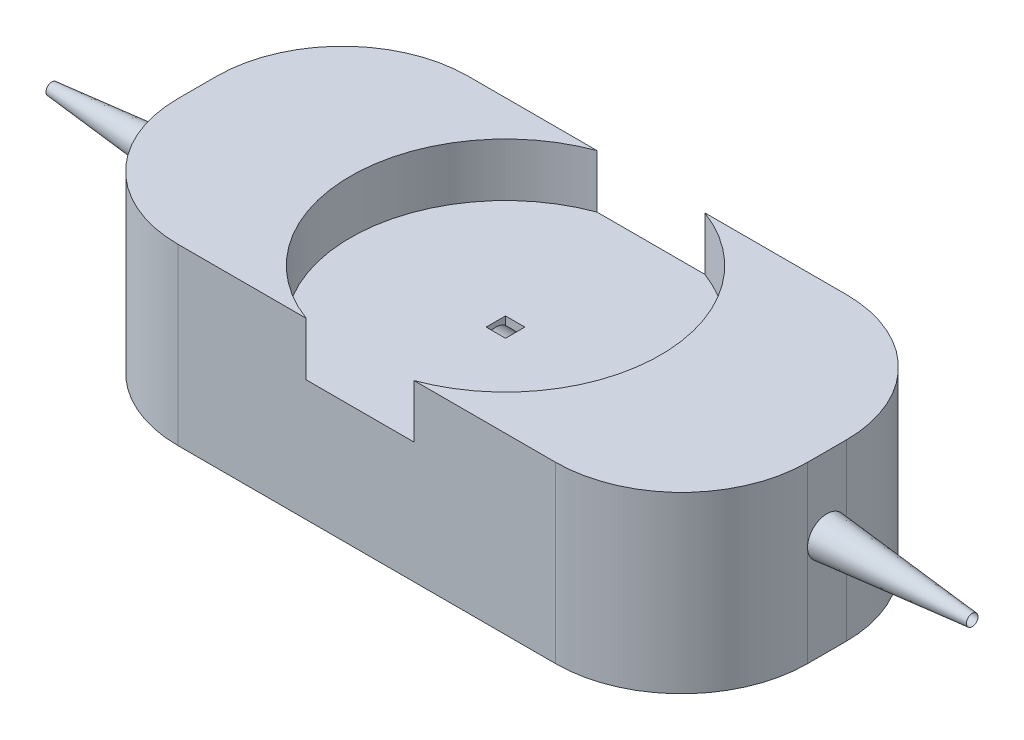
from build123d import *

# Parameters (mm, degrees)
SKETCH1_W           = 65
SKETCH1_H           = 30
BOSS_EXTRUDE1_DEPTH = 58
FILLET1_R           = 13
SKETCH15_W          = 83.696095513
SKETCH15_H          = 31.69844841
CUT_EXTRUDE7_DEPTH  = 50
SKETCH18_R          = 16
CUT_EXTRUDE10_DEPTH = 5.5
CUT_EXTRUDE12_REACH = 90.397
SKETCH3_R           = 1.6
SKETCH21_W          = 2
SKETCH21_H          = 2
CUT_EXTRUDE13_DEPTH = 8


with BuildPart() as part:
    # Sketch1 → Boss-Extrude1 (new body)
    with BuildSketch(Plane(origin=(0, 0, 0), x_dir=(1, 0, 0), z_dir=(0, 1, 0))):
        with Locations((7.5, 0)):
            Rectangle(SKETCH1_W, SKETCH1_H)
    extrude(amount=BOSS_EXTRUDE1_DEPTH)

    # Fillet1
    fillet1_edges = [part.edges().sort_by_distance(p)[0] for p in [
        (40, 29, 15),
        (-25, 29, 15),
        (-25, 29, -15),
        (40, 29, -15),
    ]]
    fillet(fillet1_edges, radius=FILLET1_R)

    # Sketch15 → Cut-Extrude7 (cut)
    with BuildSketch(Plane(origin=(0, -10, 0), x_dir=(-1, 0, 0), z_dir=(0, -1, 0))):
        with Locations((-0.057440767, 0.030479277)):
            Rectangle(SKETCH15_W, SKETCH15_H)
    extrude(amount=-CUT_EXTRUDE7_DEPTH, mode=Mode.SUBTRACT)

    # Sketch18 → Cut-Extrude10 (cut)
    with BuildSketch(Plane(origin=(0, 58, 0), x_dir=(1, 0, 0), z_dir=(0, 1, 0))):
        with Locations((6.828508286, 0)):
            Circle(SKETCH18_R)
    extrude(amount=-CUT_EXTRUDE10_DEPTH, mode=Mode.SUBTRACT)

    # Sketch3 → Cut-Extrude12 (cut, up to next)
    with BuildSketch(Plane.ZY.offset(25), mode=Mode.PRIVATE) as cut_extrude12_sk1:
        with Locations((0, 50.4)):
            Circle(SKETCH3_R)
    cut_extrude12_tool1 = extrude(cut_extrude12_sk1.sketch, amount=-CUT_EXTRUDE12_REACH, mode=Mode.PRIVATE) & part.part
    add(cut_extrude12_tool1.solids().sort_by_distance((-25, 50.4, 0))[0], mode=Mode.SUBTRACT)

    # Sketch21 → Cut-Extrude13 (cut)
    with BuildSketch(Plane(origin=(0, 52.5, 0), x_dir=(1, 0, 0), z_dir=(0, 1, 0))):
        with Locations((6.828508286, 0)):
            Rectangle(SKETCH21_W, SKETCH21_H)
    extrude(amount=-CUT_EXTRUDE13_DEPTH, mode=Mode.SUBTRACT)

    # Sketch24 → Revolve1 (revolve)
    with BuildSketch(Plane.XY, mode=Mode.PRIVATE) as revolve1_sk:
        Polygon((-25, 51), (-25, 52.4), (-40, 51), align=None)
    revolve(revolve1_sk.sketch.rotate(Axis((-25, 50.4, 0), (-1, 0, 0)), 90), axis=Axis((-25, 50.4, 0), (-1, 0, 0)))

    # Sketch25 → Revolve2 (revolve)
    with BuildSketch(Plane.XY, mode=Mode.PRIVATE) as revolve2_sk:
        Polygon((39.995235715, 52.4), (54.995235715, 51), (39.995235715, 51), align=None)
    revolve(revolve2_sk.sketch.rotate(Axis((-25, 50.4, 0), (1, 0, 0)), 90), axis=Axis((-25, 50.4, 0), (1, 0, 0)))


solid = part.part
